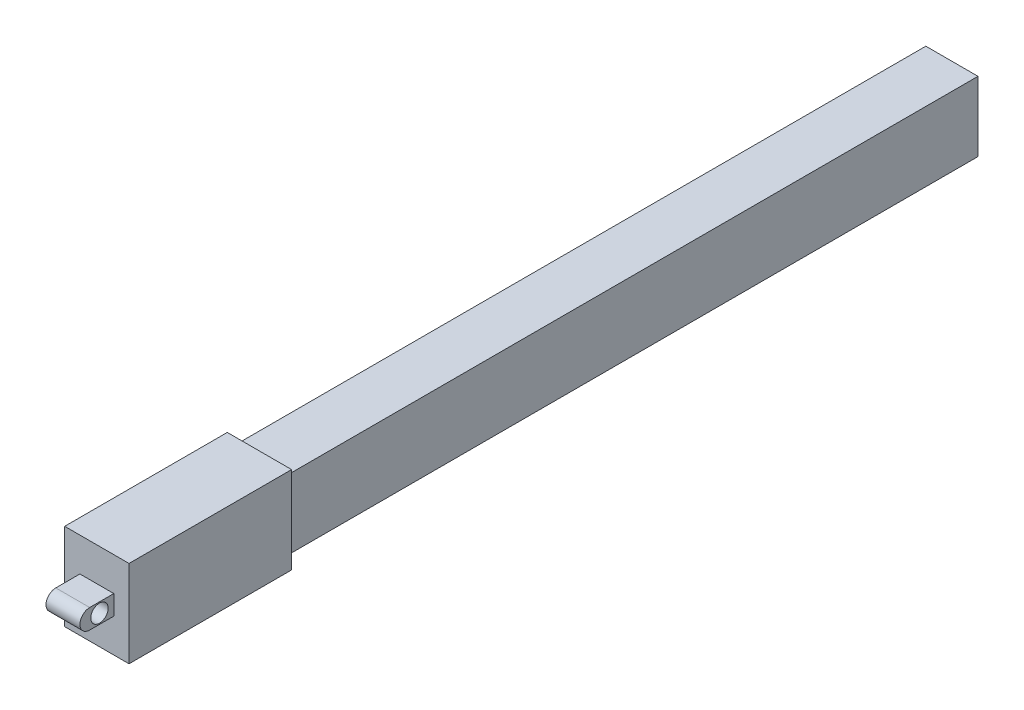
from build123d import *

# Parameters (mm, degrees)
SKETCH1_W           = 12
SKETCH1_H           = 16
BOSS_EXTRUDE1_DEPTH = 159.3
SKETCH2_W           = 14.8
SKETCH2_H           = 20
BOSS_EXTRUDE2_DEPTH = 37.4
SKETCH3_W           = 7.8
SKETCH3_H           = 4.5
BOSS_EXTRUDE3_DEPTH = 7.8
SKETCH4_R           = 2
CUT_EXTRUDE1_DEPTH  = 206.055943586
SKETCH5_W           = 6.1
SKETCH5_H           = 9
CUT_EXTRUDE2_DEPTH  = 192.2


with BuildPart() as part:
    # Sketch1 → Boss-Extrude1 (new body)
    with BuildSketch(Plane.XY):
        Rectangle(SKETCH1_W, SKETCH1_H)
    extrude(amount=BOSS_EXTRUDE1_DEPTH)

    # Sketch2 → Boss-Extrude2 (add)
    with BuildSketch(Plane.XY.offset(159.3)):
        Rectangle(SKETCH2_W, SKETCH2_H)
    extrude(amount=BOSS_EXTRUDE2_DEPTH)

    # Sketch3 → Boss-Extrude3 (add)
    with BuildSketch(Plane.XY.offset(196.7)):
        Rectangle(SKETCH3_W, SKETCH3_H)
    extrude(amount=BOSS_EXTRUDE3_DEPTH)

    # Sketch4 → Cut-Extrude1 (cut, through all)
    with BuildSketch(Plane.ZY.offset(3.9)):
        with Locations((200, 0)):
            Circle(SKETCH4_R)
        with BuildLine():
            Line((202.25, -2.25), (204.5, -2.25))
            Line((204.5, -2.25), (204.5, -3.3e-08))
            ThreePointArc((204.5, -3.3e-08), (203.840990246, -1.590990269), (202.25, -2.25))
        make_face()
        with BuildLine():
            ThreePointArc((202.25, 2.25), (203.840990269, 1.590990246), (204.5, -3.3e-08))
            Line((204.5, -3.3e-08), (204.5, 2.25))
            Line((204.5, 2.25), (202.25, 2.25))
        make_face()
    extrude(amount=-CUT_EXTRUDE1_DEPTH, mode=Mode.SUBTRACT)

    # Sketch5 → Cut-Extrude2 (cut)
    with BuildSketch(Plane(origin=(0, 0, 0), x_dir=(-1, 0, 0), z_dir=(0, 0, -1))):
        Rectangle(SKETCH5_W, SKETCH5_H)
    extrude(amount=-CUT_EXTRUDE2_DEPTH, mode=Mode.SUBTRACT)


solid = part.part
